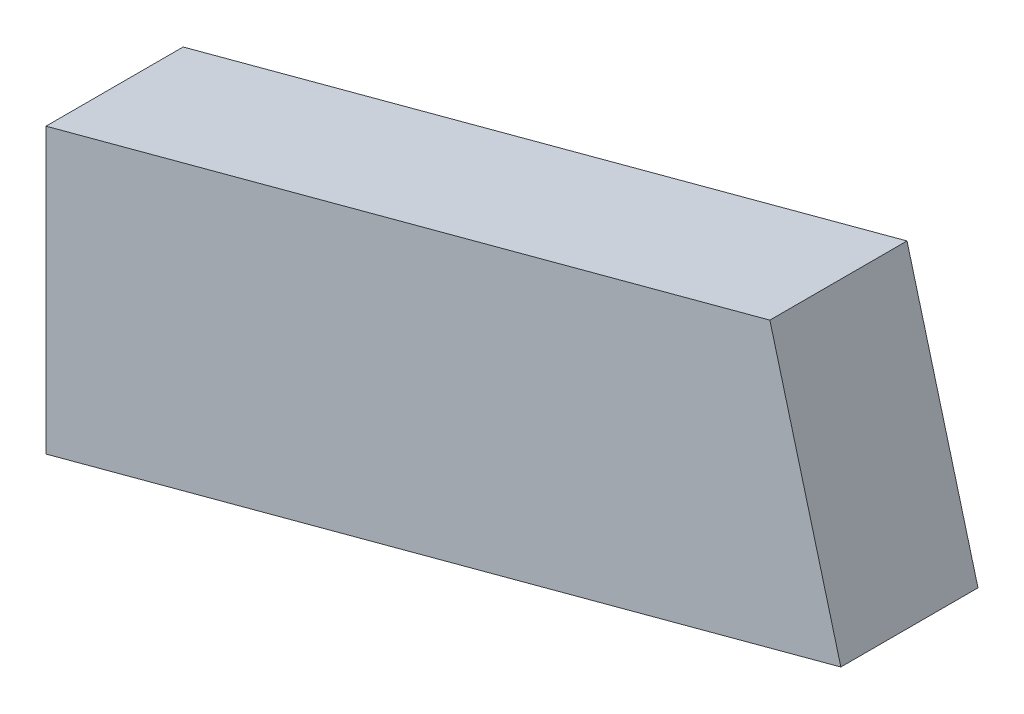
from build123d import *

# Parameters (mm, degrees)
SALIENTE_EXTRUIR3_DEPTH = 12.7


with BuildPart() as part:
    # Croquis1 → Saliente-Extruir3 (new body)
    with BuildSketch(Plane.XY):
        Polygon((-13.012744606, 43.772870845), (-13.012744606, 17.476855863), (60.590803357, 37.198867099), (54.016799611, 61.733383087), align=None)
    extrude(amount=SALIENTE_EXTRUIR3_DEPTH)


solid = part.part
